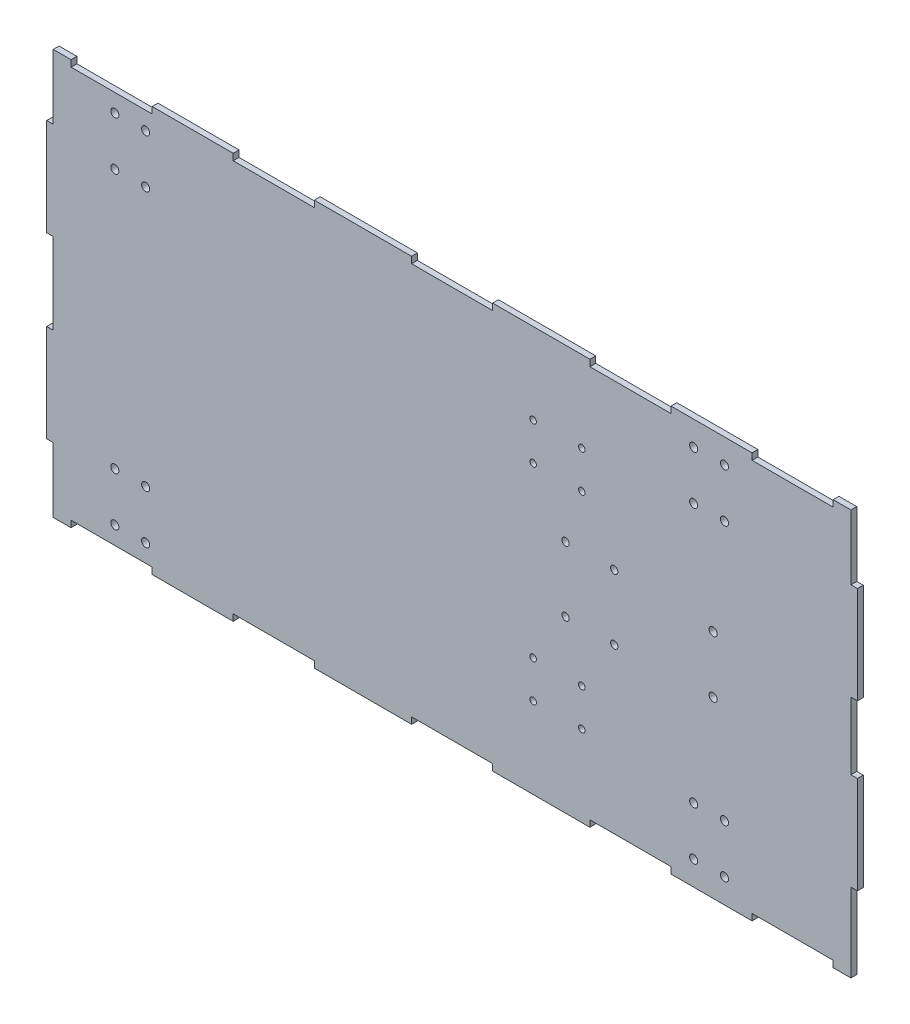
from build123d import *

# Parameters (mm, degrees)
SKETCH_1_W          = 500
SKETCH_1_H          = 250
EXTRUDE_1_DEPTH     = 3.6
SKETCH_2_W          = 50
SKETCH_2_H          = 4
CUT_EXTRUDE_1_DEPTH = 3.6
SKETCH_3_W          = 4
SKETCH_3_H          = 50
SKETCH_3_H_2        = 41.448480175
CUT_EXTRUDE_2_DEPTH = 3.6
SKETCH_4_R          = 2
CUT_EXTRUDE_3_DEPTH = 280.531679779
SKETCH_5_R          = 2
CUT_EXTRUDE_4_DEPTH = 10
SKETCH_7_R          = 2.5
CUT_EXTRUDE_5_DEPTH = 10
SKETCH_9_R          = 2.25
CUT_EXTRUDE_6_DEPTH = 280.531679779
SKETCH_10_R         = 2.5
CUT_EXTRUDE_7_DEPTH = 280.531679779


with BuildPart() as part:
    # 草图1 → 凸台-拉伸1 (new body)
    with BuildSketch(Plane.XY):
        Rectangle(SKETCH_1_W, SKETCH_1_H)
    extrude(amount=EXTRUDE_1_DEPTH)

    # 草图2 → 切除-拉伸1 (cut)
    with BuildSketch(Plane.XY.offset(3.6)):
        with Locations((0, 123)):
            Rectangle(SKETCH_2_W, SKETCH_2_H)
        with Locations((-110, 123)):
            Rectangle(SKETCH_2_W, SKETCH_2_H)
        with Locations((-210, 123)):
            Rectangle(SKETCH_2_W, SKETCH_2_H)
        with Locations((110, 123)):
            Rectangle(SKETCH_2_W, SKETCH_2_H)
        with Locations((210, 123)):
            Rectangle(SKETCH_2_W, SKETCH_2_H)
        with Locations((210, -123)):
            Rectangle(SKETCH_2_W, SKETCH_2_H)
        with Locations((110, -123)):
            Rectangle(SKETCH_2_W, SKETCH_2_H)
        with Locations((-210, -123)):
            Rectangle(SKETCH_2_W, SKETCH_2_H)
        with Locations((-110, -123)):
            Rectangle(SKETCH_2_W, SKETCH_2_H)
        with Locations((0, -123)):
            Rectangle(SKETCH_2_W, SKETCH_2_H)
    extrude(amount=-CUT_EXTRUDE_1_DEPTH, mode=Mode.SUBTRACT)

    # 草图3 → 切除-拉伸2 (cut)
    with BuildSketch(Plane.XY.offset(3.6)):
        with Locations((-248, 0)):
            Rectangle(SKETCH_3_W, SKETCH_3_H)
        with Locations((-248, 110)):
            Rectangle(SKETCH_3_W, SKETCH_3_H)
        with Locations((-248, -110)):
            Rectangle(SKETCH_3_W, SKETCH_3_H)
        with Locations((248, 4.275759912)):
            Rectangle(SKETCH_3_W, SKETCH_3_H_2)
        with Locations((248, -101.448480175)):
            Rectangle(SKETCH_3_W, SKETCH_3_H)
        with Locations((248, 110)):
            Rectangle(SKETCH_3_W, SKETCH_3_H)
    extrude(amount=-CUT_EXTRUDE_2_DEPTH, mode=Mode.SUBTRACT)

    # 草图4 → 切除-拉伸3 (cut, through all)
    with BuildSketch(Plane.XY.offset(3.6)):
        with Locations((80, 75)):
            Circle(SKETCH_4_R)
        with Locations((80, -52)):
            Circle(SKETCH_4_R)
        with Locations((80, 52)):
            Circle(SKETCH_4_R)
        with Locations((80, -75)):
            Circle(SKETCH_4_R)
    extrude(amount=-CUT_EXTRUDE_3_DEPTH, mode=Mode.SUBTRACT)

    # 草图5 → 切除-拉伸4 (cut)
    with BuildSketch(Plane.XY.offset(3.6)):
        with Locations((50, 75)):
            Circle(SKETCH_5_R)
        with Locations((50, 52)):
            Circle(SKETCH_5_R)
        with Locations((50, -52)):
            Circle(SKETCH_5_R)
        with Locations((50, -75)):
            Circle(SKETCH_5_R)
    extrude(amount=-CUT_EXTRUDE_4_DEPTH, mode=Mode.SUBTRACT)

    # 草图7 → 切除-拉伸5 (cut)
    with BuildSketch(Plane.XY.offset(3.6)):
        with Locations((161, -17.5)):
            Circle(SKETCH_7_R)
        with Locations((161, 17.5)):
            Circle(SKETCH_7_R)
    extrude(amount=-CUT_EXTRUDE_5_DEPTH, mode=Mode.SUBTRACT)

    # 草图9 → 切除-拉伸6 (cut, through all)
    with BuildSketch(Plane.XY.offset(3.6)):
        with Locations((70, 20)):
            Circle(SKETCH_9_R)
        with Locations((100, 20)):
            Circle(SKETCH_9_R)
        with Locations((70, -20)):
            Circle(SKETCH_9_R)
        with Locations((100, -20)):
            Circle(SKETCH_9_R)
    extrude(amount=-CUT_EXTRUDE_6_DEPTH, mode=Mode.SUBTRACT)

    # 草图10 → 切除-拉伸7 (cut, through all)
    with BuildSketch(Plane.XY.offset(3.6)):
        with Locations((-208, 110)):
            Circle(SKETCH_10_R)
        with Locations((-189, 110)):
            Circle(SKETCH_10_R)
        with Locations((-208, 80)):
            Circle(SKETCH_10_R)
        with Locations((-189, 80)):
            Circle(SKETCH_10_R)
        with Locations(Location((-189, -110, 0), (0, 0, 180))):
            Circle(SKETCH_10_R)
        with Locations(Location((-189, -80, 0), (0, 0, 180))):
            Circle(SKETCH_10_R)
        with Locations(Location((-208, -80, 0), (0, 0, 180))):
            Circle(SKETCH_10_R)
        with Locations(Location((-208, -110, 0), (0, 0, 180))):
            Circle(SKETCH_10_R)
        with Locations((149, 110)):
            Circle(SKETCH_10_R)
        with Locations((168, 110)):
            Circle(SKETCH_10_R)
        with Locations((149, 80)):
            Circle(SKETCH_10_R)
        with Locations((168, 80)):
            Circle(SKETCH_10_R)
        with Locations(Location((168, -110, 0), (0, 0, 180))):
            Circle(SKETCH_10_R)
        with Locations(Location((168, -80, 0), (0, 0, 180))):
            Circle(SKETCH_10_R)
        with Locations(Location((149, -80, 0), (0, 0, 180))):
            Circle(SKETCH_10_R)
        with Locations(Location((149, -110, 0), (0, 0, 180))):
            Circle(SKETCH_10_R)
    extrude(amount=-CUT_EXTRUDE_7_DEPTH, mode=Mode.SUBTRACT)


solid = part.part
